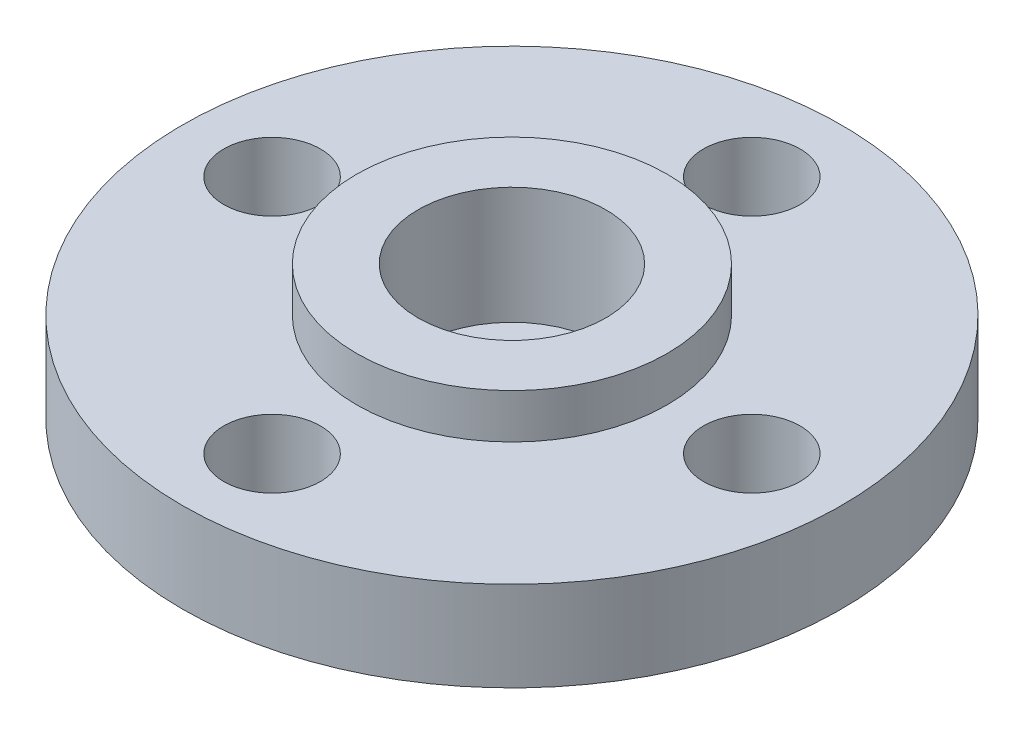
from build123d import *

# Parameters (mm, degrees)
SKETCH1_R               = 9.55
BOSS_EXTRUDE1_DEPTH     = 2.6
SKETCH2_R               = 4.5
BOSS_EXTRUDE2_DEPTH     = 1.29
CUT_EXTRUDE1_DEPTH      = 15.054789219
CUT_EXTRUDE1_DEPTH_BACK = 3.39
SKETCH3_R               = 2.72
SKETCH4_R               = 1.4
CUT_EXTRUDE2_DEPTH      = 14.753726768


with BuildPart() as part:
    # Sketch1 → Boss-Extrude1 (new body)
    with BuildSketch(Plane(origin=(0, 0, 0), x_dir=(1, 0, 0), z_dir=(0, 1, 0))):
        with Locations(Location((0, 0, 0), (0, 0, 270))):
            Circle(SKETCH1_R)
    extrude(amount=BOSS_EXTRUDE1_DEPTH)

    # Sketch2 → Boss-Extrude2 (add)
    with BuildSketch(Plane(origin=(0, 2.6, 0), x_dir=(1, 0, 0), z_dir=(0, 1, 0))):
        with Locations(Location((0, 0, 0), (0, 0, 270))):
            Circle(SKETCH2_R)
    extrude(amount=BOSS_EXTRUDE2_DEPTH)

    # Sketch3 → Cut-Extrude1 (cut, two sides: drawn at the far end of the back side and taken through both)
    with BuildSketch(Plane(origin=(0, 3.89, 0), x_dir=(1, 0, 0), z_dir=(0, 1, 0)).offset(-CUT_EXTRUDE1_DEPTH_BACK)):
        with Locations(Location((0, 0, 0), (0, 0, 270))):
            Circle(SKETCH3_R)
    extrude(amount=CUT_EXTRUDE1_DEPTH + CUT_EXTRUDE1_DEPTH_BACK, mode=Mode.SUBTRACT)

    # Sketch4 → Cut-Extrude2 (cut, through all)
    with BuildSketch(Plane(origin=(0, 2.6, 0), x_dir=(1, 0, 0), z_dir=(0, 1, 0))):
        with Locations(Location((0, 6.95, 0), (0, 0, 270))):
            Circle(SKETCH4_R)
        with Locations(Location((6.95, 0, 0), (0, 0, 270))):
            Circle(SKETCH4_R)
        with Locations(Location((0, -6.95, 0), (0, 0, 270))):
            Circle(SKETCH4_R)
        with Locations(Location((-6.95, 0, 0), (0, 0, 270))):
            Circle(SKETCH4_R)
    extrude(amount=-CUT_EXTRUDE2_DEPTH, mode=Mode.SUBTRACT)


solid = part.part
